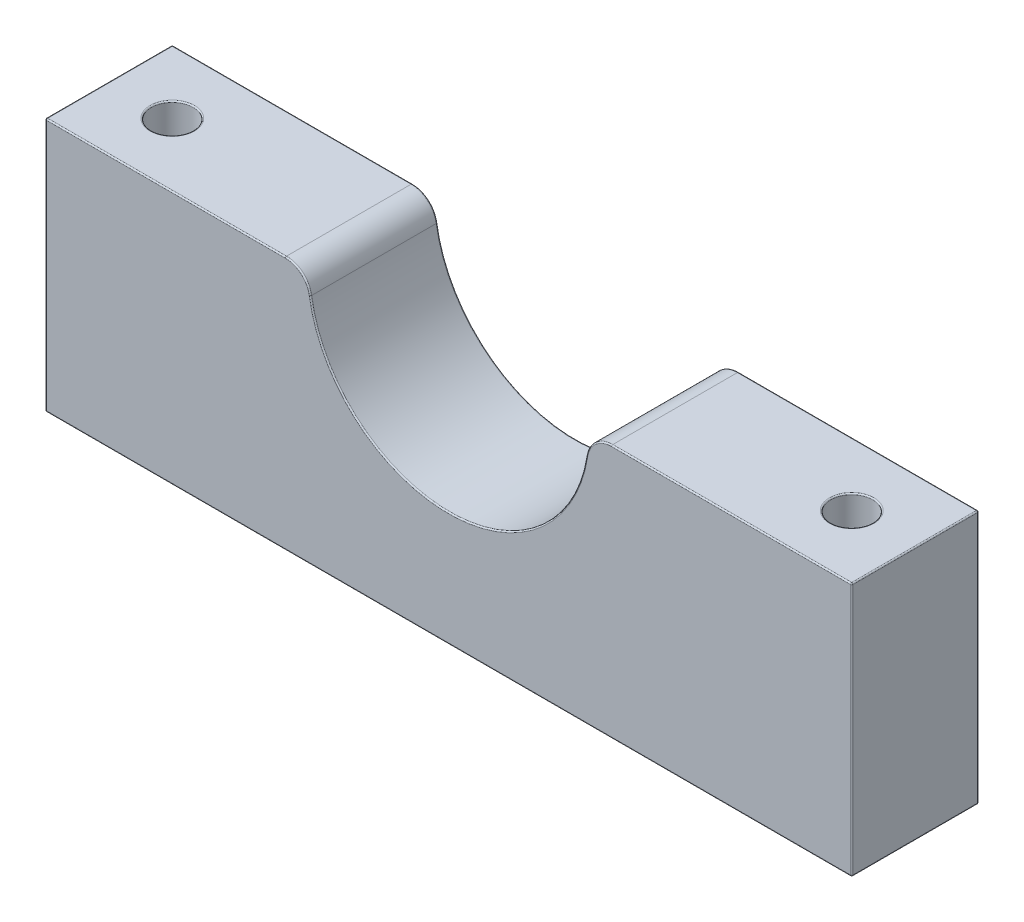
from build123d import *

# Parameters (mm, degrees)
EXTRUDE_1_DEPTH = 10
M4X0_71_D       = 3.3
FILLET_2_R      = 2
FILLET_1_R      = 0.1


with BuildPart() as part:
    # Эскиз1 → Бобышка-Вытянуть1 (new body)
    with BuildSketch(Plane.XY):
        with BuildLine():
            Line((11, 0), (31.75, 0))
            Line((31.75, 0), (31.75, -20))
            Line((31.75, -20), (-31.75, -20))
            Line((-31.75, -20), (-31.75, 0))
            Line((-31.75, 0), (-11, 0))
            ThreePointArc((-11, 0), (0, -11), (11, 0))
        make_face()
    extrude(amount=EXTRUDE_1_DEPTH)

    # Отверстие обработанное метчиком M4x0.71 (through all)
    with Locations(Plane(origin=(0, -20, 0), x_dir=(-1, 0, 0), z_dir=(0, -1, 0))):
        with Locations((26.75, -5), (-26.75, -5)):
            Hole(M4X0_71_D / 2)

    # Скругление2
    fillet_2_edges = [part.edges().sort_by_distance(p)[0] for p in [
        (11, 0, 5),
        (-11, 0, 5),
    ]]
    fillet(fillet_2_edges, radius=FILLET_2_R)

    # Скругление1
    fillet_1_edges = [part.edges().sort_by_distance(p)[0] for p in [
        (-31.75, -10, 10),
        (31.75, 0, 5),
        (31.75, -20, 5),
        (-31.75, -20, 5),
        (-31.75, 0, 5),
        (0, -20, 10),
        (31.75, -10, 10),
        (22.297616289, 0, 10),
        (25.1, -20, 5),
        (25.1, 0, 5),
        (-28.4, -20, 5),
        (-28.4, 0, 5),
        (0, -11, 0),
        (0, -11, 10),
        (-22.297616289, 0, 0),
        (-11.544345307, -0.480890949, 0),
        (11.544345307, -0.480890949, 0),
        (-22.297616289, 0, 10),
        (-11.544345307, -0.480890949, 10),
        (11.544345307, -0.480890949, 10),
        (22.297616289, 0, 0),
        (31.75, -10, 0),
        (0, -20, 0),
        (-31.75, -10, 0),
    ]]
    fillet(fillet_1_edges, radius=FILLET_1_R)


solid = part.part
